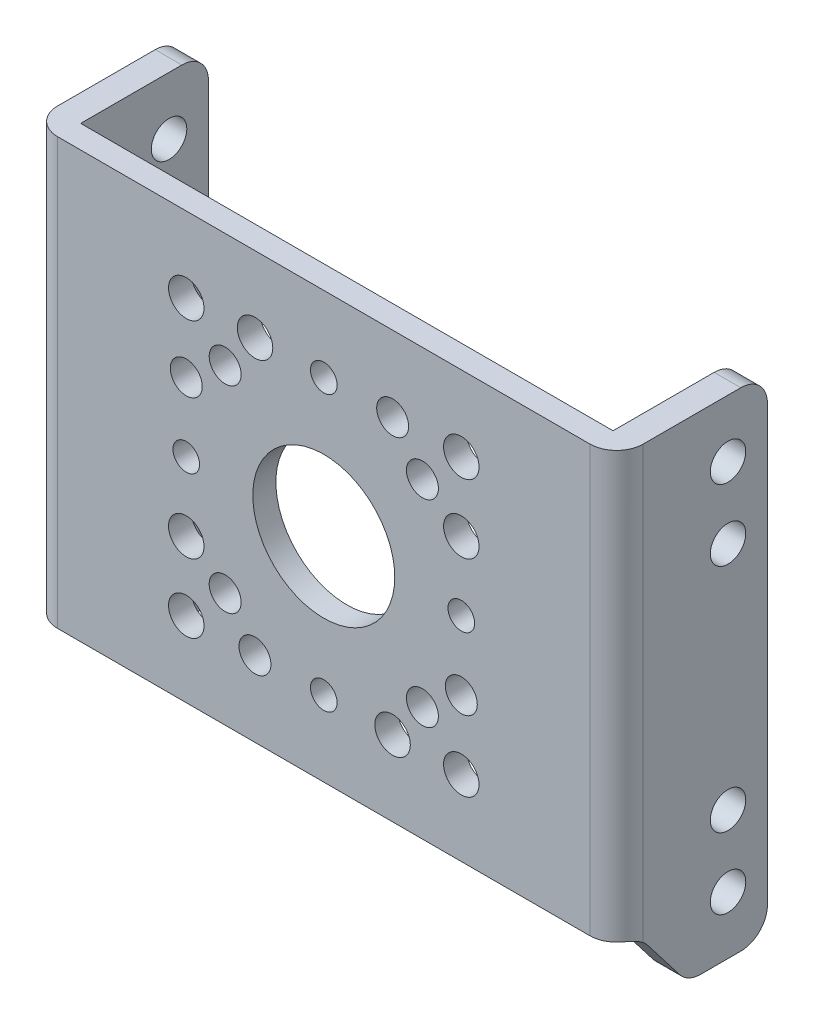
from build123d import *

# Parameters (mm, degrees)
SKETCH1_W           = 33
SKETCH1_H           = 24
SKETCH1_R           = 4
SKETCH1_R_2         = 1
SKETCH1_R_3         = 0.75
SKETCH1_R_4         = 0.9
BOSS_EXTRUDE1_DEPTH = 1.3
SKETCH2_R           = 1
BOSS_EXTRUDE2_DEPTH = 1.5
FILLET1_R           = 1.5


with BuildPart() as part:
    # Sketch1 → Boss-Extrude1 (new body)
    with BuildSketch(Plane.XY):
        Rectangle(SKETCH1_W, SKETCH1_H)
        Circle(SKETCH1_R, mode=Mode.SUBTRACT)
        with Locations((-7.75, 7.75)):
            Circle(SKETCH1_R_2, mode=Mode.SUBTRACT)
        with Locations((7.75, 7.75)):
            Circle(SKETCH1_R_2, mode=Mode.SUBTRACT)
        with Locations((7.75, -7.75)):
            Circle(SKETCH1_R_2, mode=Mode.SUBTRACT)
        with Locations((-7.75, -7.75)):
            Circle(SKETCH1_R_2, mode=Mode.SUBTRACT)
        with Locations((0, 7.75)):
            Circle(SKETCH1_R_3, mode=Mode.SUBTRACT)
        with Locations((-3.875, 7.75)):
            Circle(SKETCH1_R_2, mode=Mode.SUBTRACT)
        with Locations((3.88, 7.75)):
            Circle(SKETCH1_R_4, mode=Mode.SUBTRACT)
        with Locations((-5.557968978, 5.557968978)):
            Circle(SKETCH1_R_4, mode=Mode.SUBTRACT)
        with Locations((7.75, 3.875)):
            Circle(SKETCH1_R_2, mode=Mode.SUBTRACT)
        with Locations((7.75, 0)):
            Circle(SKETCH1_R_3, mode=Mode.SUBTRACT)
        with Locations((7.75, -3.88)):
            Circle(SKETCH1_R_4, mode=Mode.SUBTRACT)
        with Locations((5.557968978, 5.557968978)):
            Circle(SKETCH1_R_4, mode=Mode.SUBTRACT)
        with Locations((3.875, -7.75)):
            Circle(SKETCH1_R_2, mode=Mode.SUBTRACT)
        with Locations((0, -7.75)):
            Circle(SKETCH1_R_3, mode=Mode.SUBTRACT)
        with Locations((-3.88, -7.75)):
            Circle(SKETCH1_R_4, mode=Mode.SUBTRACT)
        with Locations((5.557968978, -5.557968978)):
            Circle(SKETCH1_R_4, mode=Mode.SUBTRACT)
        with Locations((-7.75, -3.875)):
            Circle(SKETCH1_R_2, mode=Mode.SUBTRACT)
        with Locations((-7.75, 0)):
            Circle(SKETCH1_R_3, mode=Mode.SUBTRACT)
        with Locations((-7.75, 3.88)):
            Circle(SKETCH1_R_4, mode=Mode.SUBTRACT)
        with Locations((-5.557968978, -5.557968978)):
            Circle(SKETCH1_R_4, mode=Mode.SUBTRACT)
    extrude(amount=BOSS_EXTRUDE1_DEPTH)

    # Sketch2 → Boss-Extrude2 (add)
    with BuildSketch(Plane(origin=(16.5, 0, 0), x_dir=(0, 0, -1), z_dir=(1, 0, 0))):
        with BuildLine():
            Line((5.7, 12), (0, 12))
            Line((0, 12), (0, -12))
            Line((0, -12), (-0.73731738, -12))
            ThreePointArc((-0.73731738, -12), (-0.075617967, -12.153837348), (0.450356003, -12.583794819))
            Line((0.450356003, -12.583794819), (2.249643997, -14.916205181))
            ThreePointArc((2.249643997, -14.916205181), (2.775617967, -15.346162652), (3.43731738, -15.5))
            Line((3.43731738, -15.5), (5.7, -15.5))
            ThreePointArc((5.7, -15.5), (6.760660172, -15.060660172), (7.2, -14))
            Line((7.2, -14), (7.2, 10.5))
            ThreePointArc((7.2, 10.5), (6.760660172, 11.560660172), (5.7, 12))
        make_face()
        with Locations(Location((4.98, -12.25, 0), (0, 0, 90))):
            Circle(SKETCH2_R, mode=Mode.SUBTRACT)
        with Locations(Location((4.98, -8.25, 0), (0, 0, 90))):
            Circle(SKETCH2_R, mode=Mode.SUBTRACT)
        with Locations(Location((4.98, 4.75, 0), (0, 0, 90))):
            Circle(SKETCH2_R, mode=Mode.SUBTRACT)
        with Locations(Location((4.98, 8.75, 0), (0, 0, 90))):
            Circle(SKETCH2_R, mode=Mode.SUBTRACT)
    boss_extrude2 = extrude(amount=-BOSS_EXTRUDE2_DEPTH)

    # Mirror1: Boss-Extrude2 across plane
    add(boss_extrude2.mirror(Plane(origin=(0, 0, 0), x_dir=(0, 0, 1), z_dir=(1, 0, 0))))

    # Fillet1
    fillet1_edges = [part.edges().sort_by_distance(p)[0] for p in [
        (-16.5, 0, 1.3),
        (16.5, 0, 1.3),
    ]]
    fillet(fillet1_edges, radius=FILLET1_R)


solid = part.part
